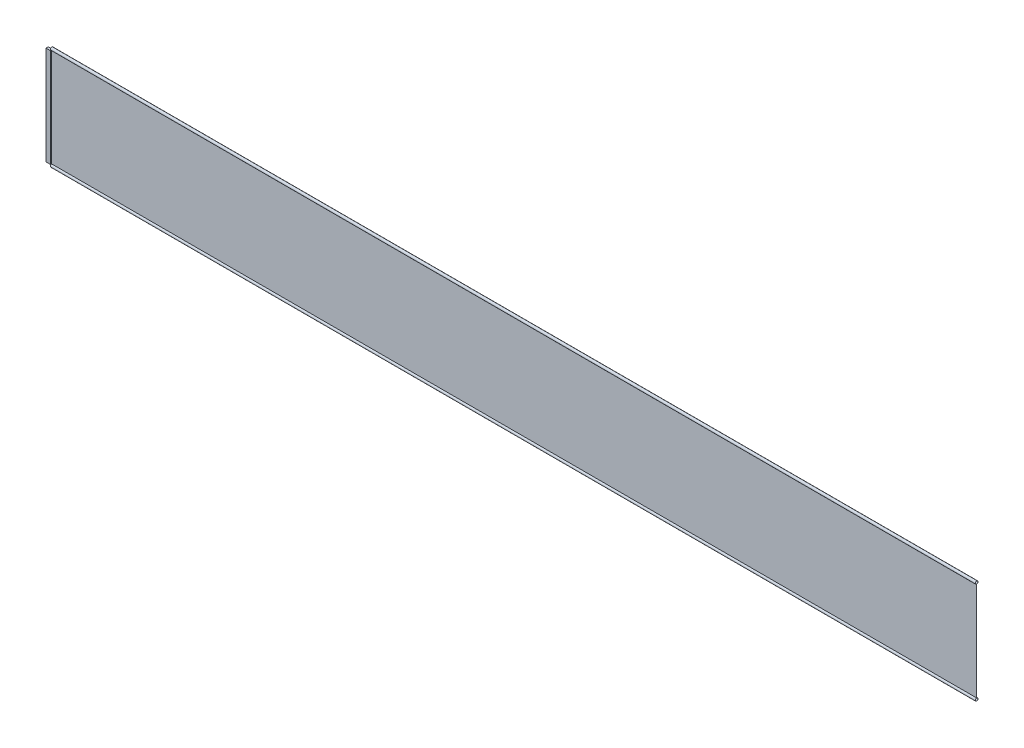
from build123d import *

# Parameters (mm, degrees)
BOSS_EXTRUDE1_START = -50
SKETCH1_W           = 200
SKETCH1_H           = 4300
BOSS_EXTRUDE1_DEPTH = 100
BOSS_EXTRUDE2_START = -1.5
SKETCH2_W           = 40349.626189349
SKETCH2_H           = 4300
BOSS_EXTRUDE2_DEPTH = 3
BOSS_EXTRUDE3_START = 3400
SKETCH3_R           = 60
SKETCH3_R_2         = 57
BOSS_EXTRUDE3_DEPTH = 40349.626189349
BOSS_EXTRUDE4_START = 3400
SKETCH4_R           = 60
SKETCH4_R_2         = 57
BOSS_EXTRUDE4_DEPTH = 40349.626189349


with BuildPart() as part:
    # Sketch1 → Boss-Extrude1 (new body)
    with BuildSketch(Plane.XY.offset(BOSS_EXTRUDE1_START)):
        with Locations((3300, 0)):
            Rectangle(SKETCH1_W, SKETCH1_H)
    extrude(amount=BOSS_EXTRUDE1_DEPTH)

    # Sketch2 → Boss-Extrude2 (add)
    with BuildSketch(Plane.XY.offset(BOSS_EXTRUDE2_START)):
        with Locations((23574.813094675, 0)):
            Rectangle(SKETCH2_W, SKETCH2_H)
    extrude(amount=BOSS_EXTRUDE2_DEPTH)


with BuildPart() as body_2:
    # Sketch3 → Boss-Extrude3 (new body)
    with BuildSketch(Plane(origin=(0, 0, 0), x_dir=(0, 0, -1), z_dir=(1, 0, 0)).offset(BOSS_EXTRUDE3_START)):
        with Locations((0, -2210)):
            Circle(SKETCH3_R)
        with Locations((0, -2210)):
            Circle(SKETCH3_R_2, mode=Mode.SUBTRACT)
    extrude(amount=BOSS_EXTRUDE3_DEPTH)


with BuildPart() as body_3:
    # Sketch4 → Boss-Extrude4 (new body)
    with BuildSketch(Plane(origin=(0, 0, 0), x_dir=(0, 0, -1), z_dir=(1, 0, 0)).offset(BOSS_EXTRUDE4_START)):
        with Locations((0, 2210)):
            Circle(SKETCH4_R)
        with Locations((0, 2210)):
            Circle(SKETCH4_R_2, mode=Mode.SUBTRACT)
    extrude(amount=BOSS_EXTRUDE4_DEPTH)


solid = Compound([part.part, body_2.part, body_3.part])
